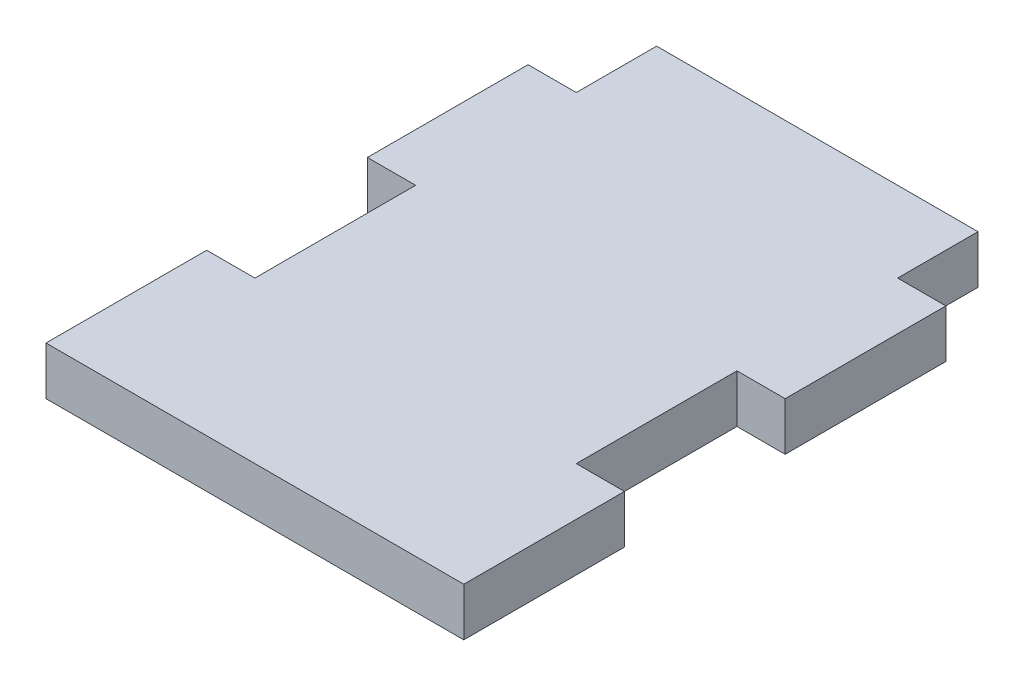
from build123d import *

# Parameters (mm, degrees)
SKETCH_1_W      = 20
SKETCH_1_H      = 35
SKETCH_1_W_2    = 3
SKETCH_1_H_2    = 10
EXTRUDE_1_DEPTH = 3


with BuildPart() as part:
    # 草图1 → 凸台-拉伸1 (new body)
    with BuildSketch(Plane(origin=(0, 0, 0), x_dir=(1, 0, 0), z_dir=(0, 1, 0))):
        Rectangle(SKETCH_1_W, SKETCH_1_H)
        with Locations((11.5, 7.5)):
            Rectangle(SKETCH_1_W_2, SKETCH_1_H_2)
        with Locations((11.5, -12.5)):
            Rectangle(SKETCH_1_W_2, SKETCH_1_H_2)
        with Locations((-11.5, -12.5)):
            Rectangle(SKETCH_1_W_2, SKETCH_1_H_2)
        with Locations((-11.5, 7.5)):
            Rectangle(SKETCH_1_W_2, SKETCH_1_H_2)
    extrude(amount=EXTRUDE_1_DEPTH)


solid = part.part
